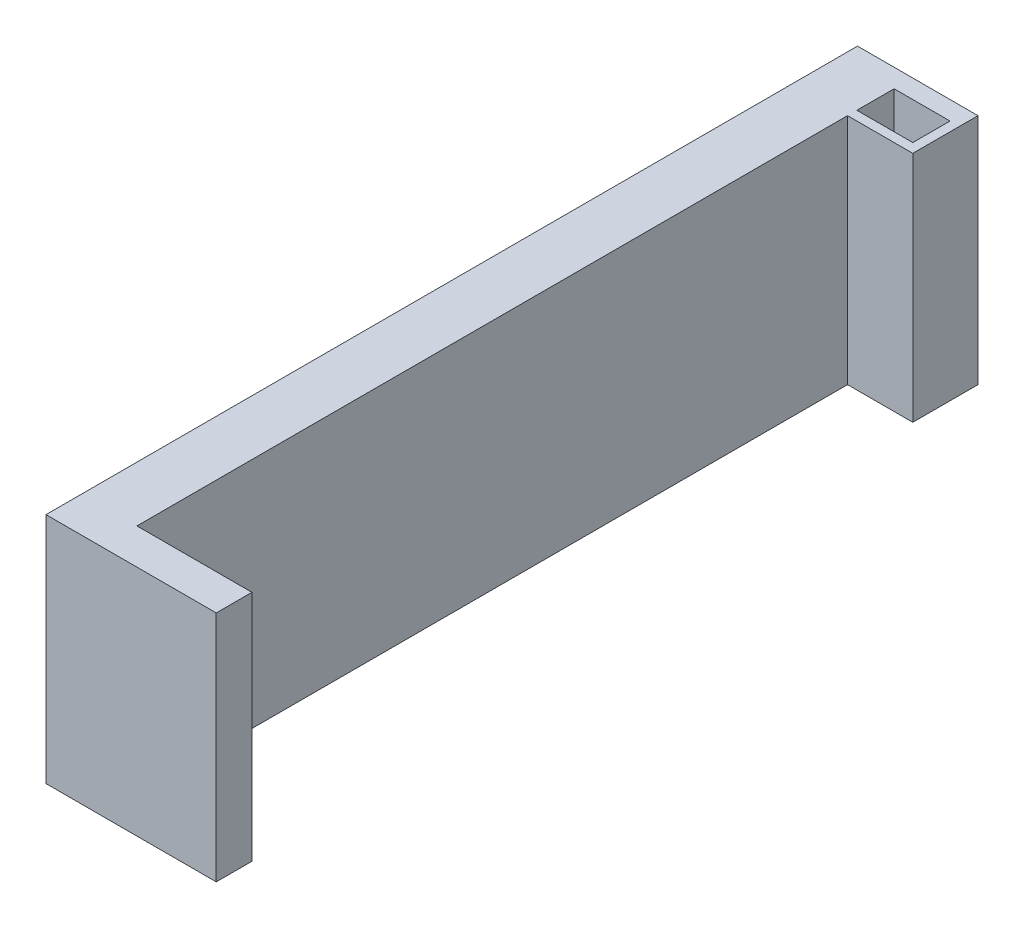
from build123d import *

# Parameters (mm, degrees)
SCHIZZO2_W                   = 5.93
SCHIZZO2_H                   = 25
ESTRUSIONE_ESTRUSIONE1_DEPTH = 83.26
SCHIZZO3_W                   = 2
SCHIZZO3_H                   = 25
ESTRUSIONE_ESTRUSIONE2_DEPTH = 7
SCHIZZO4_W                   = 1
SCHIZZO4_H                   = 25
ESTRUSIONE_ESTRUSIONE3_DEPTH = 5
SCHIZZO5_W                   = 1
SCHIZZO5_H                   = 25
ESTRUSIONE_ESTRUSIONE4_DEPTH = 6
SCHIZZO7_W                   = 5.93
SCHIZZO7_H                   = 25
ESTRUSIONE_ESTRUSIONE5_DEPTH = 3.83
SCHIZZO9_W                   = 3.83
SCHIZZO9_H                   = 25
ESTRUSIONE_ESTRUSIONE7_DEPTH = 12.34


with BuildPart() as part:
    # Schizzo2 → Estrusione-Estrusione1 (new body)
    with BuildSketch(Plane.XY):
        with Locations((0, 12.5)):
            Rectangle(SCHIZZO2_W, SCHIZZO2_H)
    extrude(amount=-ESTRUSIONE_ESTRUSIONE1_DEPTH)

    # Schizzo3 → Estrusione-Estrusione2 (add)
    with BuildSketch(Plane(origin=(2.965, 0, 0), x_dir=(0, 0, -1), z_dir=(1, 0, 0))):
        with Locations((82.26, 12.5)):
            Rectangle(SCHIZZO3_W, SCHIZZO3_H)
    extrude(amount=ESTRUSIONE_ESTRUSIONE2_DEPTH)

    # Schizzo4 → Estrusione-Estrusione3 (add)
    with BuildSketch(Plane.XY.offset(-81.26)):
        with Locations((9.465, 12.5)):
            Rectangle(SCHIZZO4_W, SCHIZZO4_H)
    extrude(amount=ESTRUSIONE_ESTRUSIONE3_DEPTH)

    # Schizzo5 → Estrusione-Estrusione4 (add)
    with BuildSketch(Plane.ZY.offset(-8.965)):
        with Locations((-76.76, 12.5)):
            Rectangle(SCHIZZO5_W, SCHIZZO5_H)
    extrude(amount=ESTRUSIONE_ESTRUSIONE4_DEPTH)

    # Schizzo7 → Estrusione-Estrusione5 (add)
    with BuildSketch(Plane.XY):
        with Locations((0, 12.5)):
            Rectangle(SCHIZZO7_W, SCHIZZO7_H)
    extrude(amount=ESTRUSIONE_ESTRUSIONE5_DEPTH)

    # Schizzo9 → Estrusione-Estrusione7 (add)
    with BuildSketch(Plane(origin=(2.965, 0, 0), x_dir=(0, 0, -1), z_dir=(1, 0, 0))):
        with Locations((-1.915, 12.5)):
            Rectangle(SCHIZZO9_W, SCHIZZO9_H)
    extrude(amount=ESTRUSIONE_ESTRUSIONE7_DEPTH)


solid = part.part
